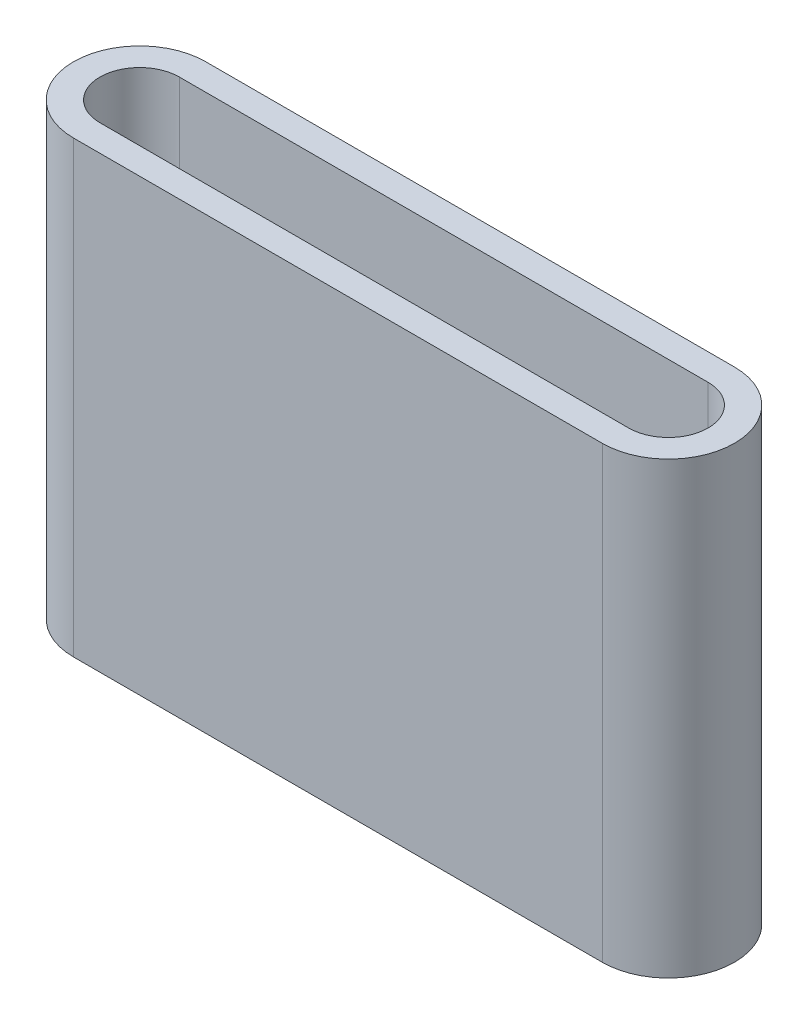
from build123d import *

# Parameters (mm, degrees)
EXTRUDE_1_DEPTH      = 20
EXTRUDE_1_DEPTH_BACK = 10
EXTRUDE_1_2_DEPTH    = 55


with BuildPart() as part:
    # 草图1 → Extrude 1 (new, two sides: drawn at the far end of the back side and taken through both)
    with BuildSketch(Plane(origin=(0, 0, 0), x_dir=(1, 0, 0), z_dir=(0, 1, 0)).offset(-EXTRUDE_1_DEPTH_BACK)):
        with BuildLine():
            Line((0, 12.5), (100, 12.5))
            ThreePointArc((100, 12.5), (112.5, 0), (100, -12.5))
            Line((100, -12.5), (0, -12.5))
            ThreePointArc((0, -12.5), (-12.5, 0), (0, 12.5))
        make_face()
    extrude(amount=EXTRUDE_1_DEPTH + EXTRUDE_1_DEPTH_BACK)

    # 草图2 → Extrude 1 2 (add)
    with BuildSketch(Plane(origin=(0, 20, 0), x_dir=(1, 0, 0), z_dir=(0, 1, 0))):
        with BuildLine():
            Line((100, 12.5), (0, 12.5))
            ThreePointArc((0, 12.5), (-12.5, 0), (0, -12.5))
            Line((0, -12.5), (100, -12.5))
            ThreePointArc((100, -12.5), (112.5, 0), (100, 12.5))
        make_face()
        with BuildLine():
            Line((100, 7.5), (0, 7.5))
            ThreePointArc((0, 7.5), (-7.5, 0), (0, -7.5))
            Line((0, -7.5), (100, -7.5))
            ThreePointArc((100, -7.5), (107.5, 0), (100, 7.5))
        make_face(mode=Mode.SUBTRACT)
    extrude(amount=EXTRUDE_1_2_DEPTH)


solid = part.part
